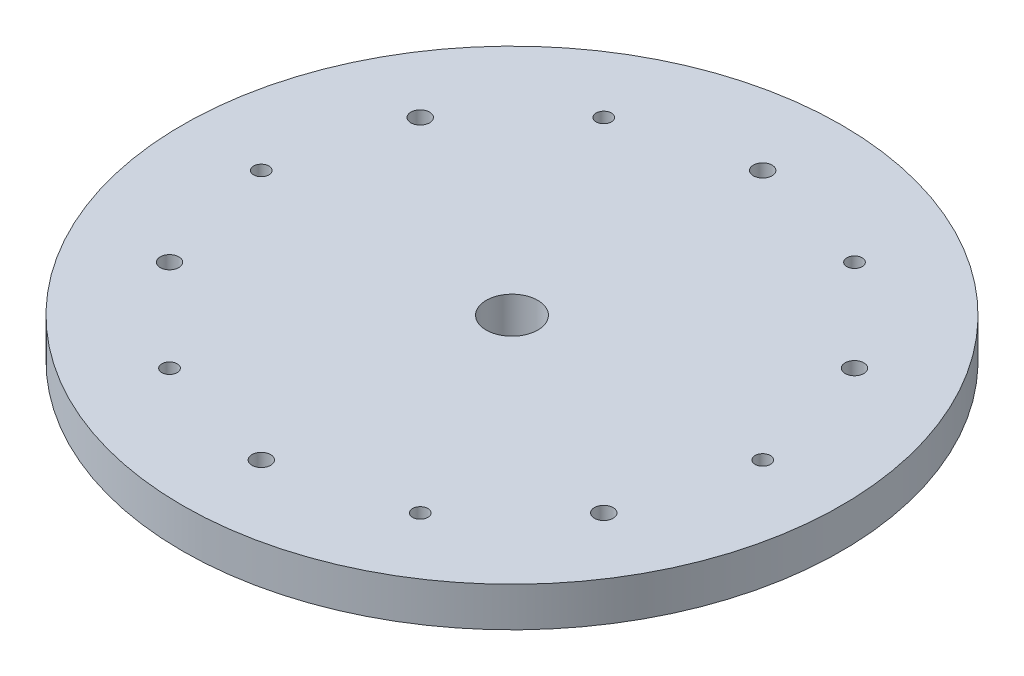
from build123d import *

# Parameters (mm, degrees)
SKETCH1_R           = 50
SKETCH1_R_2         = 1.25
SKETCH1_R_3         = 1.5
SKETCH1_R_4         = 4
BOSS_EXTRUDE1_DEPTH = 6
MOVE_FACE1_BY       = 0.08
MOVE_FACE1_2_BY     = 0.08
MOVE_FACE1_3_BY     = 0.08
MOVE_FACE1_4_BY     = 0.08
MOVE_FACE1_5_BY     = 0.08
MOVE_FACE1_6_BY     = 0.08
MOVE_FACE1_7_BY     = 0.08
MOVE_FACE1_8_BY     = 0.08
MOVE_FACE1_9_BY     = 0.08
MOVE_FACE1_10_BY    = 0.08
MOVE_FACE1_11_BY    = 0.08
MOVE_FACE1_12_BY    = 0.08
MOVE_FACE1_13_BY    = 0.08
MOVE_FACE1_14_BY    = 0.08


with BuildPart() as part:
    # Sketch1 → Boss-Extrude1 (new body)
    with BuildSketch(Plane(origin=(0, 0, 0), x_dir=(1, 0, 0), z_dir=(0, 1, 0))):
        with Locations(Location((0, 0, 0), (0, 0, 270))):
            Circle(SKETCH1_R)
        with Locations(Location((38.1, 0, 0), (0, 0, 270))):
            Circle(SKETCH1_R_2, mode=Mode.SUBTRACT)
        with Locations(Location((19.05, -32.995567884, 0), (0, 0, 270))):
            Circle(SKETCH1_R_2, mode=Mode.SUBTRACT)
        with Locations(Location((-19.05, -32.995567884, 0), (0, 0, 270))):
            Circle(SKETCH1_R_2, mode=Mode.SUBTRACT)
        with Locations(Location((-38.1, 0, 0), (0, 0, 270))):
            Circle(SKETCH1_R_2, mode=Mode.SUBTRACT)
        with Locations(Location((-19.05, 32.995567884, 0), (0, 0, 270))):
            Circle(SKETCH1_R_2, mode=Mode.SUBTRACT)
        with Locations(Location((19.05, 32.995567884, 0), (0, 0, 270))):
            Circle(SKETCH1_R_2, mode=Mode.SUBTRACT)
        with Locations(Location((0, 38.1, 0), (0, 0, 270))):
            Circle(SKETCH1_R_3, mode=Mode.SUBTRACT)
        with Locations(Location((32.995567884, 19.05, 0), (0, 0, 270))):
            Circle(SKETCH1_R_3, mode=Mode.SUBTRACT)
        with Locations(Location((32.995567884, -19.05, 0), (0, 0, 270))):
            Circle(SKETCH1_R_3, mode=Mode.SUBTRACT)
        with Locations(Location((0, -38.1, 0), (0, 0, 270))):
            Circle(SKETCH1_R_3, mode=Mode.SUBTRACT)
        with Locations(Location((-32.995567884, -19.05, 0), (0, 0, 270))):
            Circle(SKETCH1_R_3, mode=Mode.SUBTRACT)
        with Locations(Location((-32.995567884, 19.05, 0), (0, 0, 270))):
            Circle(SKETCH1_R_3, mode=Mode.SUBTRACT)
        with Locations(Location((0, 0, 0), (0, 0, 270))):
            Circle(SKETCH1_R_4, mode=Mode.SUBTRACT)
    extrude(amount=BOSS_EXTRUDE1_DEPTH)

    # Move Face1: a curved face moved outward by 0.08
    add(Solid.thicken(part.faces().sort_by_distance((0, 3, -4))[0], MOVE_FACE1_BY))

    # Move Face1 2: a curved face moved outward by 0.08
    add(Solid.thicken(part.faces().sort_by_distance((0, 3, -50))[0], MOVE_FACE1_2_BY))

    # Move Face1 3: a curved face moved outward by 0.08
    add(Solid.thicken(part.faces().sort_by_distance((38.1, 3, -1.25))[0], MOVE_FACE1_3_BY))

    # Move Face1 4: a curved face moved outward by 0.08
    add(Solid.thicken(part.faces().sort_by_distance((0, 3, -39.6))[0], MOVE_FACE1_4_BY))

    # Move Face1 5: a curved face moved outward by 0.08
    add(Solid.thicken(part.faces().sort_by_distance((19.05, 3, 31.745567884))[0], MOVE_FACE1_5_BY))

    # Move Face1 6: a curved face moved outward by 0.08
    add(Solid.thicken(part.faces().sort_by_distance((-19.05, 3, 31.745567884))[0], MOVE_FACE1_6_BY))

    # Move Face1 7: a curved face moved outward by 0.08
    add(Solid.thicken(part.faces().sort_by_distance((-38.1, 3, -1.25))[0], MOVE_FACE1_7_BY))

    # Move Face1 8: a curved face moved outward by 0.08
    add(Solid.thicken(part.faces().sort_by_distance((-19.05, 3, -34.245567884))[0], MOVE_FACE1_8_BY))

    # Move Face1 9: a curved face moved outward by 0.08
    add(Solid.thicken(part.faces().sort_by_distance((19.05, 3, -34.245567884))[0], MOVE_FACE1_9_BY))

    # Move Face1 10: a curved face moved outward by 0.08
    add(Solid.thicken(part.faces().sort_by_distance((32.995567884, 3, -20.55))[0], MOVE_FACE1_10_BY))

    # Move Face1 11: a curved face moved outward by 0.08
    add(Solid.thicken(part.faces().sort_by_distance((32.995567884, 3, 17.55))[0], MOVE_FACE1_11_BY))

    # Move Face1 12: a curved face moved outward by 0.08
    add(Solid.thicken(part.faces().sort_by_distance((0, 3, 36.6))[0], MOVE_FACE1_12_BY))

    # Move Face1 13: a curved face moved outward by 0.08
    add(Solid.thicken(part.faces().sort_by_distance((-32.995567884, 3, 17.55))[0], MOVE_FACE1_13_BY))

    # Move Face1 14: a curved face moved outward by 0.08
    add(Solid.thicken(part.faces().sort_by_distance((-32.995567884, 3, -20.55))[0], MOVE_FACE1_14_BY))


solid = part.part
